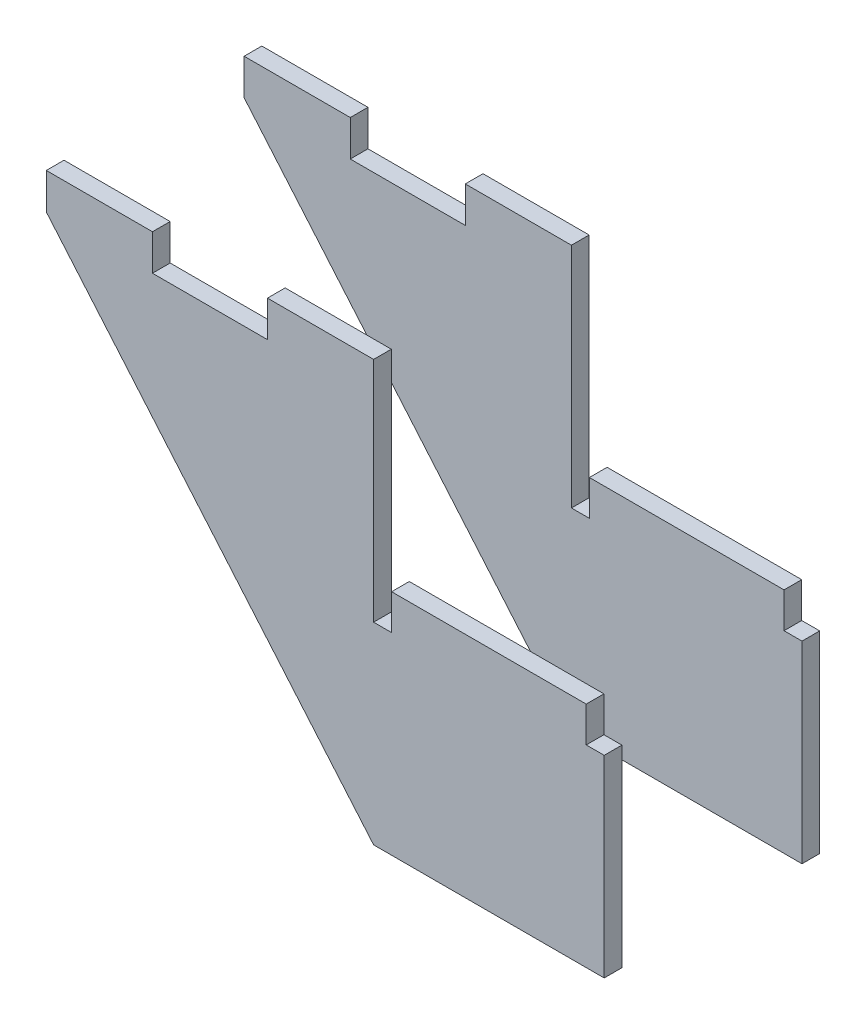
from build123d import *

# Parameters (mm, degrees)
BOSS_EXTRUDE1_START = 236.892664
BOSS_EXTRUDE1_DEPTH = 10
BOSS_EXTRUDE2_START = 125.085498
BOSS_EXTRUDE2_DEPTH = 10


with BuildPart() as part:
    # Sketch1 → Boss-Extrude1 (new body)
    with BuildSketch(Plane.XY.offset(BOSS_EXTRUDE1_START)):
        Polygon((-210.16, -2161.218921834), (-200, -2161.218921834), (-200, -2141.218921834), (-90, -2141.218921834), (-90, -2161.218921834), (-79.84, -2161.218921834), (-79.84, -2270.218921834), (-210.16, -2270.218921834), (-395.16, -2052.911580455), (-395.16, -2032.591580455), (-335.16, -2032.591580455), (-335.16, -2052.911580455), (-270.16, -2052.911580455), (-270.16, -2032.591580455), (-210.16, -2032.591580455), (-210.16, -2052.911580455), align=None)
    extrude(amount=BOSS_EXTRUDE1_DEPTH)


with BuildPart() as body_2:
    # Sketch1<2> → Boss-Extrude2 (new body)
    with BuildSketch(Plane.XY.offset(BOSS_EXTRUDE2_START)):
        Polygon((-210.16, -2161.218921834), (-200, -2161.218921834), (-200, -2141.218921834), (-90, -2141.218921834), (-90, -2161.218921834), (-79.84, -2161.218921834), (-79.84, -2270.218921834), (-210.16, -2270.218921834), (-395.16, -2052.911580455), (-395.16, -2032.591580455), (-335.16, -2032.591580455), (-335.16, -2052.911580455), (-270.16, -2052.911580455), (-270.16, -2032.591580455), (-210.16, -2032.591580455), (-210.16, -2052.911580455), align=None)
    extrude(amount=BOSS_EXTRUDE2_DEPTH)


solid = Compound([part.part, body_2.part])
